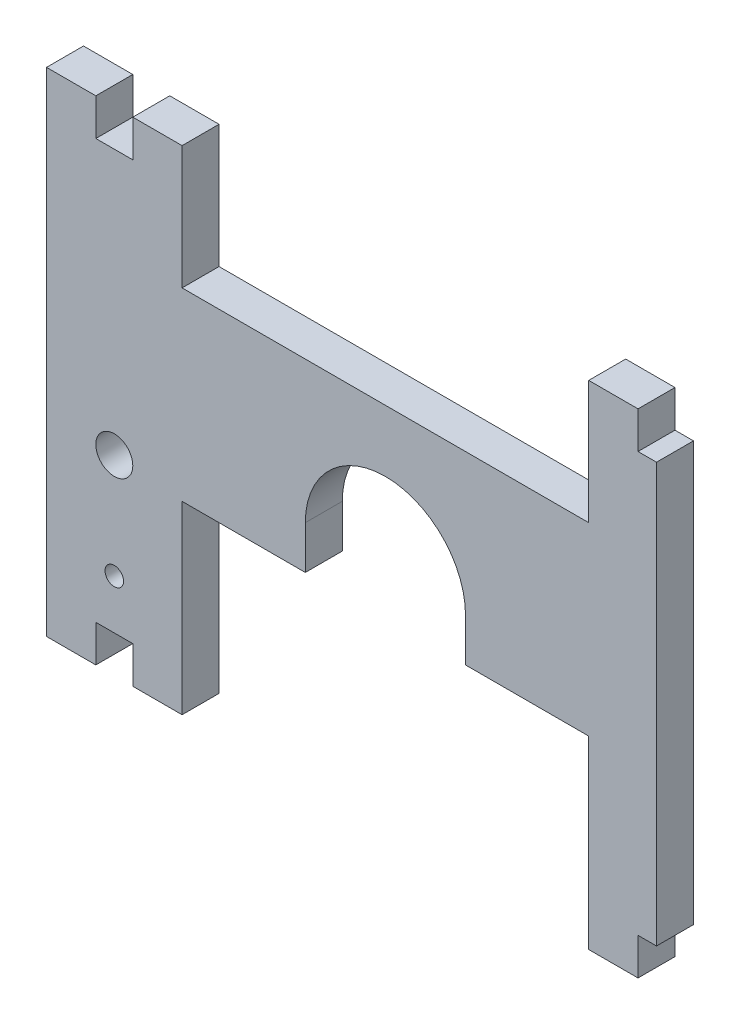
from build123d import *

# Parameters (mm, degrees)
BOSS_EXTRU_1_DEPTH      = 6
ESQUISSE2_R             = 3
ESQUISSE2_R_2           = 1.5
ENL_V_MAT_EXTRU_1_DEPTH = 30
ENL_V_MAT_EXTRU_3_DEPTH = 10


with BuildPart() as part:
    # Esquisse1 → Boss.-Extru.1 (new body)
    with BuildSketch(Plane.XY):
        with BuildLine():
            Line((-14, 74), (-14, 80))
            Line((-14, 80), (-22, 80))
            Line((-22, 80), (-22, 0))
            Line((-22, 0), (-14, 0))
            Line((-14, 0), (-14, 6))
            Line((-14, 6), (-8, 6))
            Line((-8, 6), (-8, 0))
            Line((-8, 0), (0, 0))
            Line((0, 0), (0, 30))
            Line((0, 30), (20, 30))
            Line((20, 30), (20, 37))
            ThreePointArc((20, 37), (33, 50), (46, 37))
            Line((46, 37), (46, 30))
            Line((46, 30), (66, 30))
            Line((66, 30), (66, 0))
            Line((66, 0), (74, 0))
            Line((74, 0), (74, 6))
            Line((74, 6), (80, 6))
            Line((80, 6), (80, 0))
            Line((80, 0), (88, 0))
            Line((88, 0), (88, 80))
            Line((88, 80), (80, 80))
            Line((80, 80), (80, 74))
            Line((80, 74), (74, 74))
            Line((74, 74), (74, 80))
            Line((74, 80), (66, 80))
            Line((66, 80), (66, 60))
            Line((66, 60), (0, 60))
            Line((0, 60), (0, 80))
            Line((0, 80), (-8, 80))
            Line((-8, 80), (-8, 74))
            Line((-8, 74), (-14, 74))
        make_face()
    extrude(amount=BOSS_EXTRU_1_DEPTH)

    # Esquisse2 → Enlèv. mat.-Extru.1 (cut)
    with BuildSketch(Plane.XY.offset(6)):
        with Locations((-11, 31)):
            Circle(ESQUISSE2_R)
        with Locations((-11, 14)):
            Circle(ESQUISSE2_R_2)
    extrude(amount=-ENL_V_MAT_EXTRU_1_DEPTH, mode=Mode.SUBTRACT)

    # Esquisse5 → Enlèv. mat.-Extru.3 (cut)
    with BuildSketch(Plane.XY.offset(6)):
        Polygon((77, 74), (77, 6), (80, 6), (80, 0), (88, 0), (88, 80), (80, 80), (80, 74), align=None)
    extrude(amount=-ENL_V_MAT_EXTRU_3_DEPTH, mode=Mode.SUBTRACT)


solid = part.part
